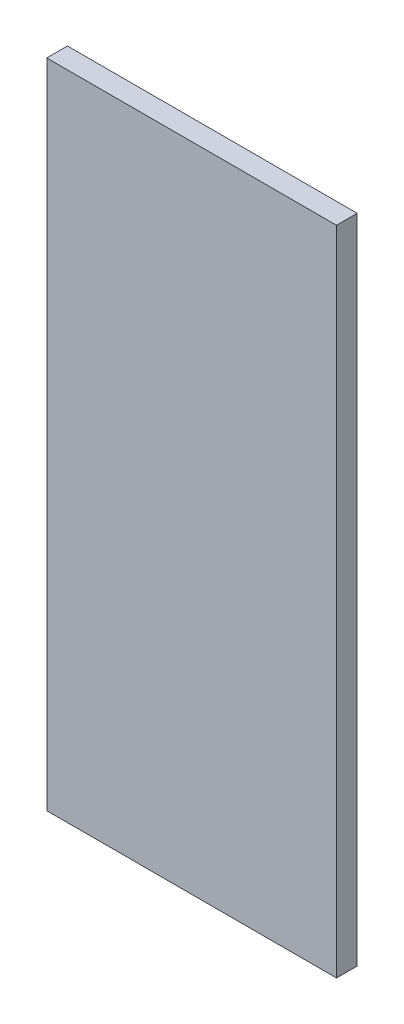
from build123d import *

# Parameters (mm, degrees)
SKETCH1_W           = 88.9
SKETCH1_H           = 200
BOSS_EXTRUDE1_DEPTH = 6.35


with BuildPart() as part:
    # Sketch1 → Boss-Extrude1 (new body)
    with BuildSketch(Plane.XY):
        with Locations((44.45, 100)):
            Rectangle(SKETCH1_W, SKETCH1_H)
    extrude(amount=BOSS_EXTRUDE1_DEPTH)


solid = part.part
